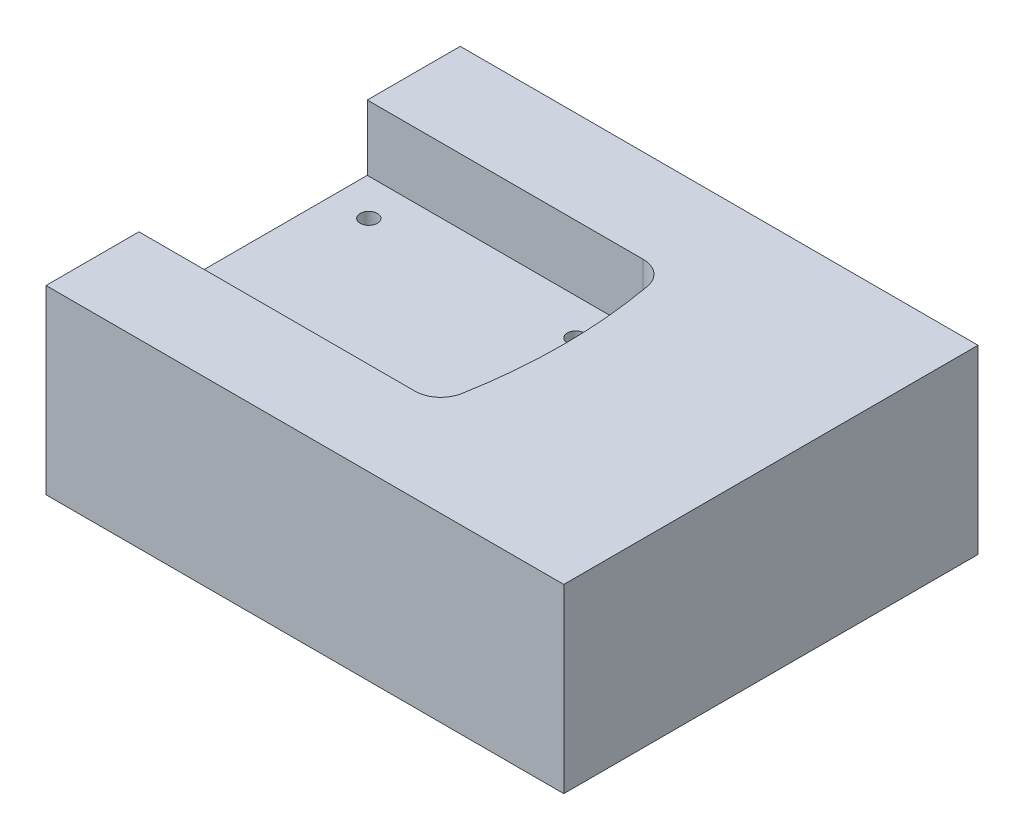
from build123d import *

# Parameters (mm, degrees)
SKETCH1_W           = 127
SKETCH1_H           = 101.6
BOSS_EXTRUDE1_DEPTH = 44.45
CUT_EXTRUDE1_DEPTH  = 16
SKETCH3_R           = 2.1082
CUT_EXTRUDE2_DEPTH  = 87.152727757


with BuildPart() as part:
    # Sketch1 → Boss-Extrude1 (new body)
    with BuildSketch(Plane(origin=(0, 0, 0), x_dir=(1, 0, 0), z_dir=(0, 1, 0))):
        Rectangle(SKETCH1_W, SKETCH1_H)
    extrude(amount=BOSS_EXTRUDE1_DEPTH)

    # Sketch2 → Cut-Extrude1 (cut)
    with BuildSketch(Plane(origin=(0, 44.45, 0), x_dir=(1, 0, 0), z_dir=(0, 1, 0))):
        with BuildLine():
            Line((-63.5, 28), (4.191617227, 28))
            ThreePointArc((4.191617227, 28), (8.25897768, 26.526379697), (10.43854445, 22.789473684))
            ThreePointArc((10.43854445, 22.789473684), (12.5, 0), (10.43854445, -22.789473684))
            ThreePointArc((10.43854445, -22.789473684), (8.25897768, -26.526379697), (4.191617227, -28))
            Line((4.191617227, -28), (-63.5, -28))
            Line((-63.5, -28), (-63.5, 28))
        make_face()
    extrude(amount=-CUT_EXTRUDE1_DEPTH, mode=Mode.SUBTRACT)

    # Sketch3 → Cut-Extrude2 (cut, through all)
    with BuildSketch(Plane(origin=(0, 28.45, 0), x_dir=(1, 0, 0), z_dir=(0, 1, 0))):
        with Locations(Location((-54.175, 19.05, 0), (0, 0, 270))):
            Circle(SKETCH3_R)
        with Locations(Location((-54.175, -19.05, 0), (0, 0, 270))):
            Circle(SKETCH3_R)
        with Locations(Location((-3.375, 19.05, 0), (0, 0, 270))):
            Circle(SKETCH3_R)
        with Locations(Location((-3.375, -19.05, 0), (0, 0, 270))):
            Circle(SKETCH3_R)
    extrude(amount=-CUT_EXTRUDE2_DEPTH, mode=Mode.SUBTRACT)


solid = part.part
